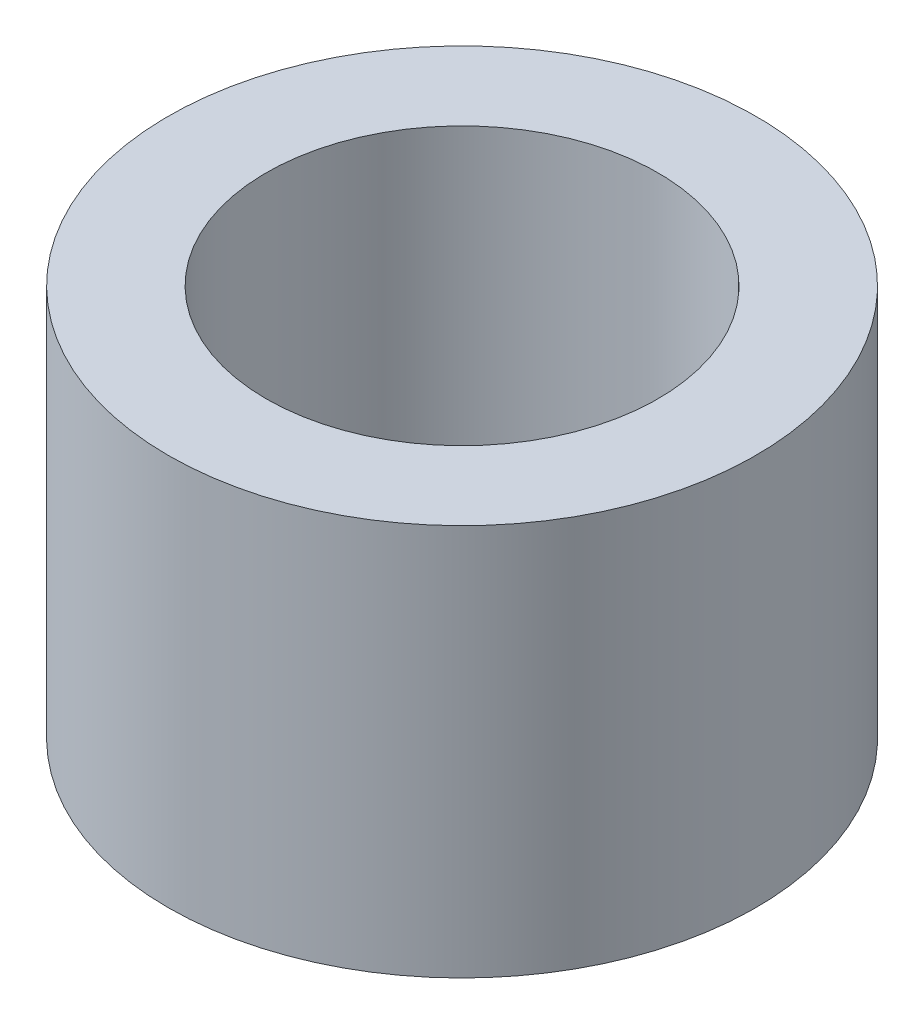
from build123d import *

# Parameters (mm, degrees)
SKETCH1_R           = 2.4
SKETCH1_R_2         = 1.6
BOSS_EXTRUDE1_DEPTH = 3.2


with BuildPart() as part:
    # Sketch1 → Boss-Extrude1 (new body)
    with BuildSketch(Plane(origin=(0, 0, 0), x_dir=(1, 0, 0), z_dir=(0, 1, 0))):
        with Locations(Location((0, 0, 0), (0, 0, 270))):
            Circle(SKETCH1_R)
        with Locations(Location((0, 0, 0), (0, 0, 270))):
            Circle(SKETCH1_R_2, mode=Mode.SUBTRACT)
    extrude(amount=BOSS_EXTRUDE1_DEPTH)


solid = part.part
